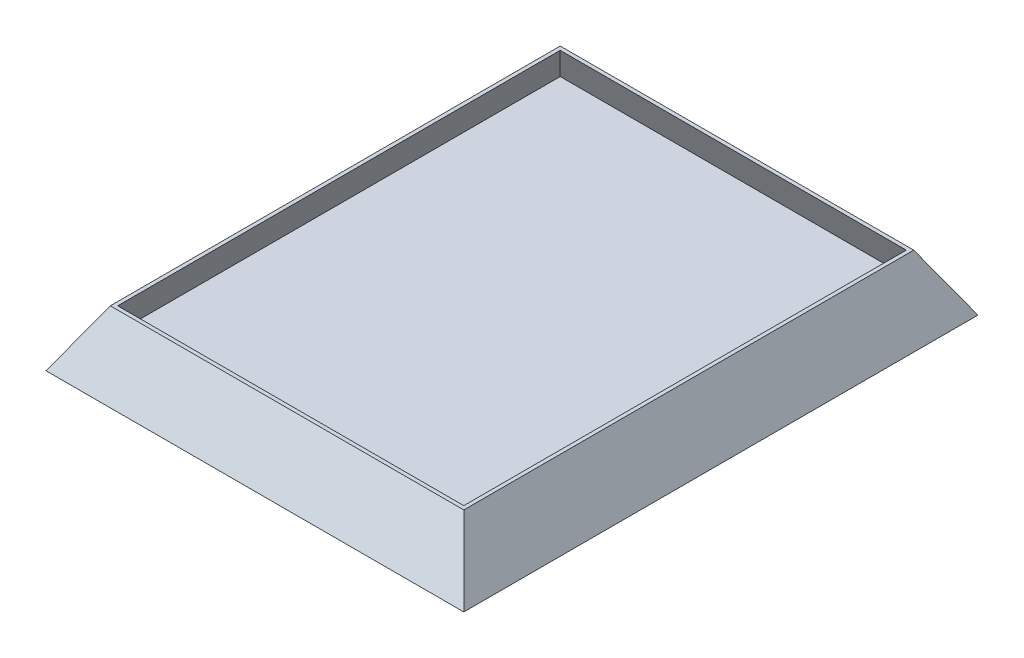
from build123d import *

# Parameters (mm, degrees)
SHELL1_T = -5.08


with BuildPart() as part:
    # Sketch2 → Loft1 section 0
    with BuildSketch(Plane(origin=(0, -88.9, 0), x_dir=(1, 0, 0), z_dir=(0, 1, 0))):
        with BuildLine():
            Line((330.2, 406.4), (-330.2, 406.4))
            Line((-330.2, 406.4), (-330.2, -406.4))
            Line((-330.2, -406.4), (330.2, -406.4))
            Line((330.2, -406.4), (330.2, 406.4))
        make_face()
    # Sketch1 → Loft1 section 1
    with BuildSketch(Plane(origin=(0, 0, 0), x_dir=(1, 0, 0), z_dir=(0, 1, 0))):
        with BuildLine():
            Line((-279.4, -355.6), (279.4, -355.6))
            Line((279.4, -355.6), (279.4, 355.6))
            Line((279.4, 355.6), (-279.4, 355.6))
            Line((-279.4, 355.6), (-279.4, -355.6))
        make_face()
    loft()

    # Shell1
    shell1_openings = [part.faces().sort_by_distance(p)[0] for p in [
        (0, 0, 0),
    ]]
    offset(amount=SHELL1_T, openings=shell1_openings, kind=Kind.INTERSECTION)


solid = part.part
